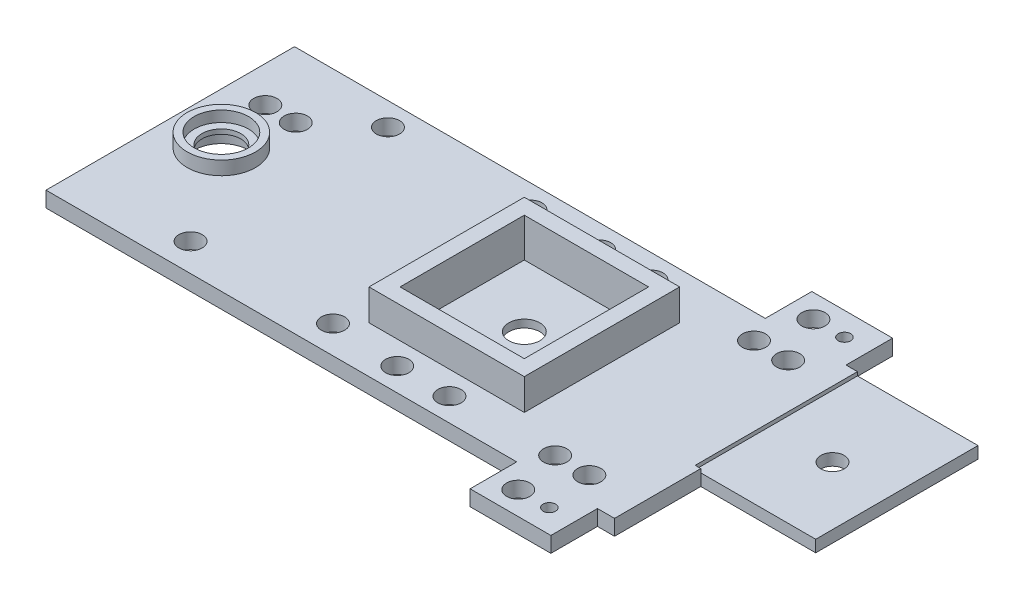
from build123d import *

# Parameters (mm, degrees)
SKETCH1_W            = 279.4
SKETCH1_H            = 101.6
BOSS_EXTRUDE1_DEPTH  = 6.35
SKETCH2_R            = 13.97
BOSS_EXTRUDE3_DEPTH  = 5.55625
SKETCH9_R            = 11.1125
CUT_EXTRUDE4_DEPTH   = 4.445
CUT_EXTRUDE5_START   = -5.55625
SKETCH10_R           = 11.1125
CUT_EXTRUDE5_DEPTH   = 5.55625
SKETCH11_R           = 7.9375
CUT_EXTRUDE6_DEPTH   = 285.078633923
SKETCH12_R           = 6.35
CUT_EXTRUDE7_DEPTH   = 285.051619429
SKETCH22_W           = 63.5
SKETCH22_H           = 63.5
BOSS_EXTRUDE7_DEPTH  = 12.7
SKETCH25_W           = 50.8
SKETCH25_H           = 50.8
CUT_EXTRUDE11_DEPTH  = 15.875
SKETCH32_R           = 4.7625
CUT_EXTRUDE12_DEPTH  = 6.35
SKETCH38_W           = 46.99
SKETCH38_H           = 18.470251096
CUT_EXTRUDE13_DEPTH  = 6.35
SKETCH60_R           = 4.7625
CUT_EXTRUDE23_DEPTH  = 6.35
SKETCH64_R           = 4.7625
CUT_EXTRUDE24_DEPTH  = 285.264471927
SKETCH69_W           = 33.02
SKETCH69_H           = 6.35
BOSS_EXTRUDE10_DEPTH = 19.05
SKETCH70_R           = 4.7625
SKETCH70_R_2         = 2.54
CUT_EXTRUDE26_DEPTH  = 6.35
SKETCH76_R           = 4.7625
CUT_EXTRUDE29_DEPTH  = 6.35
SKETCH77_W           = 46.99
SKETCH77_H           = 16.7871648
CUT_EXTRUDE30_DEPTH  = 6.35
SKETCH78_W           = 49.276
SKETCH78_H           = 66.342584104
CUT_EXTRUDE32_DEPTH  = 1.524
SKETCH79_R           = 4.7625
CUT_EXTRUDE33_DEPTH  = 4.826


with BuildPart() as part:
    # Sketch1 → Boss-Extrude1 (new body)
    with BuildSketch(Plane(origin=(0, 0, 0), x_dir=(1, 0, 0), z_dir=(0, 1, 0))):
        with Locations((-139.7, 0)):
            Rectangle(SKETCH1_W, SKETCH1_H)
    extrude(amount=BOSS_EXTRUDE1_DEPTH)

    # Sketch2 → Boss-Extrude3 (add)
    with BuildSketch(Plane(origin=(0, 6.35, 0), x_dir=(1, 0, 0), z_dir=(0, 1, 0))):
        with Locations(Location((-258.510557857, 0, 0), (0, 0, 90))):
            Circle(SKETCH2_R)
    extrude(amount=BOSS_EXTRUDE3_DEPTH)

    # Sketch9 → Cut-Extrude4 (cut)
    with BuildSketch(Plane(origin=(0, 11.90625, 0), x_dir=(1, 0, 0), z_dir=(0, 1, 0))):
        with Locations(Location((-258.510557857, 0, 0), (0, 0, 270))):
            Circle(SKETCH9_R)
    extrude(amount=-CUT_EXTRUDE4_DEPTH, mode=Mode.SUBTRACT)

    # Sketch10 → Cut-Extrude5 (cut)
    with BuildSketch(Plane(origin=(0, 0, 0), x_dir=(-1, 0, 0), z_dir=(0, -1, 0)).offset(CUT_EXTRUDE5_START)):
        with Locations(Location((258.510557857, 0, 0), (0, 0, 270))):
            Circle(SKETCH10_R)
    extrude(amount=CUT_EXTRUDE5_DEPTH, mode=Mode.SUBTRACT)

    # Sketch11 → Cut-Extrude6 (cut, through all)
    with BuildSketch(Plane(origin=(0, 7.46125, 0), x_dir=(1, 0, 0), z_dir=(0, 1, 0))):
        with Locations(Location((-258.510557857, 0, 0), (0, 0, 270))):
            Circle(SKETCH11_R)
    extrude(amount=-CUT_EXTRUDE6_DEPTH, mode=Mode.SUBTRACT)

    # Sketch12 → Cut-Extrude7 (cut, through all)
    with BuildSketch(Plane(origin=(0, 6.35, 0), x_dir=(1, 0, 0), z_dir=(0, 1, 0))):
        with Locations(Location((-134.666203771, 0, 0), (0, 0, 270))):
            Circle(SKETCH12_R)
    extrude(amount=-CUT_EXTRUDE7_DEPTH, mode=Mode.SUBTRACT)

    # Sketch22 → Boss-Extrude7 (add)
    with BuildSketch(Plane(origin=(0, 6.35, 0), x_dir=(1, 0, 0), z_dir=(0, 1, 0))):
        with Locations((-134.666203771, 0)):
            Rectangle(SKETCH22_W, SKETCH22_H)
    extrude(amount=BOSS_EXTRUDE7_DEPTH)

    # Sketch25 → Cut-Extrude11 (cut)
    with BuildSketch(Plane(origin=(0, 19.05, 0), x_dir=(1, 0, 0), z_dir=(0, 1, 0))):
        with Locations((-134.666203771, 0)):
            Rectangle(SKETCH25_W, SKETCH25_H)
    extrude(amount=-CUT_EXTRUDE11_DEPTH, mode=Mode.SUBTRACT)

    # Sketch32 → Cut-Extrude12 (cut)
    with BuildSketch(Plane(origin=(0, 6.35, 0), x_dir=(1, 0, 0), z_dir=(0, 1, 0))):
        with Locations(Location((-67.44195898, -40.64, 0), (0, 0, 270))):
            Circle(SKETCH32_R)
        with Locations(Location((-81.41195898, -40.64, 0), (0, 0, 270))):
            Circle(SKETCH32_R)
        with Locations(Location((-67.44195898, 40.64, 0), (0, 0, 270))):
            Circle(SKETCH32_R)
        with Locations(Location((-81.41195898, 40.64, 0), (0, 0, 270))):
            Circle(SKETCH32_R)
    extrude(amount=-CUT_EXTRUDE12_DEPTH, mode=Mode.SUBTRACT)

    # Sketch38 → Cut-Extrude13 (cut)
    with BuildSketch(Plane(origin=(0, 6.35, 0), x_dir=(1, 0, 0), z_dir=(0, 1, 0))):
        with Locations((-23.495, -24.777709652)):
            Rectangle(SKETCH38_W, SKETCH38_H)
    extrude(amount=-CUT_EXTRUDE13_DEPTH, mode=Mode.SUBTRACT)

    # Sketch60 → Cut-Extrude23 (cut)
    with BuildSketch(Plane(origin=(0, 6.35, 0), x_dir=(1, 0, 0), z_dir=(0, 1, 0))):
        with Locations(Location((-231.7492444, 41.324145444, 0), (0, 0, 270))):
            Circle(SKETCH60_R)
        with Locations(Location((-231.7492444, -39.369341378, 0), (0, 0, 270))):
            Circle(SKETCH60_R)
        with Locations(Location((-173.509244294, -39.369341378, 0), (0, 0, 270))):
            Circle(SKETCH60_R)
        with Locations(Location((-173.509244294, 41.324145444, 0), (0, 0, 270))):
            Circle(SKETCH60_R)
    extrude(amount=-CUT_EXTRUDE23_DEPTH, mode=Mode.SUBTRACT)

    # Sketch64 → Cut-Extrude24 (cut, through all)
    with BuildSketch(Plane(origin=(0, 6.35, 0), x_dir=(1, 0, 0), z_dir=(0, 1, 0))):
        with Locations(Location((-145.334203771, -41.275, 0), (0, 0, 270))):
            Circle(SKETCH64_R)
        with Locations(Location((-123.998203771, -41.275, 0), (0, 0, 270))):
            Circle(SKETCH64_R)
    cut_extrude24 = extrude(amount=-CUT_EXTRUDE24_DEPTH, mode=Mode.SUBTRACT)

    # Mirror1: Cut-Extrude24 across plane
    add(cut_extrude24.mirror(Plane.XY), mode=Mode.SUBTRACT)

    # Sketch69 → Boss-Extrude10 (add)
    with BuildSketch(Plane.XY.offset(50.8)):
        with Locations((-70.465355554, 3.175)):
            Rectangle(SKETCH69_W, SKETCH69_H)
    boss_extrude10 = extrude(amount=BOSS_EXTRUDE10_DEPTH)

    # Sketch70 → Cut-Extrude26 (cut)
    with BuildSketch(Plane(origin=(0, 6.35, 0), x_dir=(1, 0, 0), z_dir=(0, 1, 0))):
        with Locations(Location((-76.815355554, -60.325, 0), (0, 0, 270))):
            Circle(SKETCH70_R)
        with Locations(Location((-64.115355554, -60.325, 0), (0, 0, 270))):
            Circle(SKETCH70_R_2)
    cut_extrude26 = extrude(amount=-CUT_EXTRUDE26_DEPTH, mode=Mode.SUBTRACT)

    # Mirror2: Boss-Extrude10, Cut-Extrude26 across plane
    add(boss_extrude10.mirror(Plane.XY))
    add(cut_extrude26.mirror(Plane.XY), mode=Mode.SUBTRACT)

    # Sketch76 → Cut-Extrude29 (cut)
    with BuildSketch(Plane(origin=(0, 6.35, 0), x_dir=(1, 0, 0), z_dir=(0, 1, 0))):
        with Locations(Location((-264.668, 24.13, 0), (0, 0, 270))):
            Circle(SKETCH76_R)
        with Locations(Location((-252.222, 24.13, 0), (0, 0, 270))):
            Circle(SKETCH76_R)
    extrude(amount=-CUT_EXTRUDE29_DEPTH, mode=Mode.SUBTRACT)

    # Sketch77 → Cut-Extrude30 (cut)
    with BuildSketch(Plane(origin=(0, 6.35, 0), x_dir=(1, 0, 0), z_dir=(0, 1, 0))):
        with Locations((-23.495, -42.4064176)):
            Rectangle(SKETCH77_W, SKETCH77_H)
    extrude(amount=-CUT_EXTRUDE30_DEPTH, mode=Mode.SUBTRACT)

    # Sketch78 → Cut-Extrude32 (cut)
    with BuildSketch(Plane(origin=(0, 6.35, 0), x_dir=(1, 0, 0), z_dir=(0, 1, 0))):
        with Locations((-24.638, 17.628707948)):
            Rectangle(SKETCH78_W, SKETCH78_H)
    extrude(amount=-CUT_EXTRUDE32_DEPTH, mode=Mode.SUBTRACT)

    # Sketch79 → Cut-Extrude33 (cut)
    with BuildSketch(Plane(origin=(0, 4.826, 0), x_dir=(1, 0, 0), z_dir=(0, 1, 0))):
        with Locations(Location((-23.876, 15.191415896, 0), (0, 0, 270))):
            Circle(SKETCH79_R)
    extrude(amount=-CUT_EXTRUDE33_DEPTH, mode=Mode.SUBTRACT)


solid = part.part
